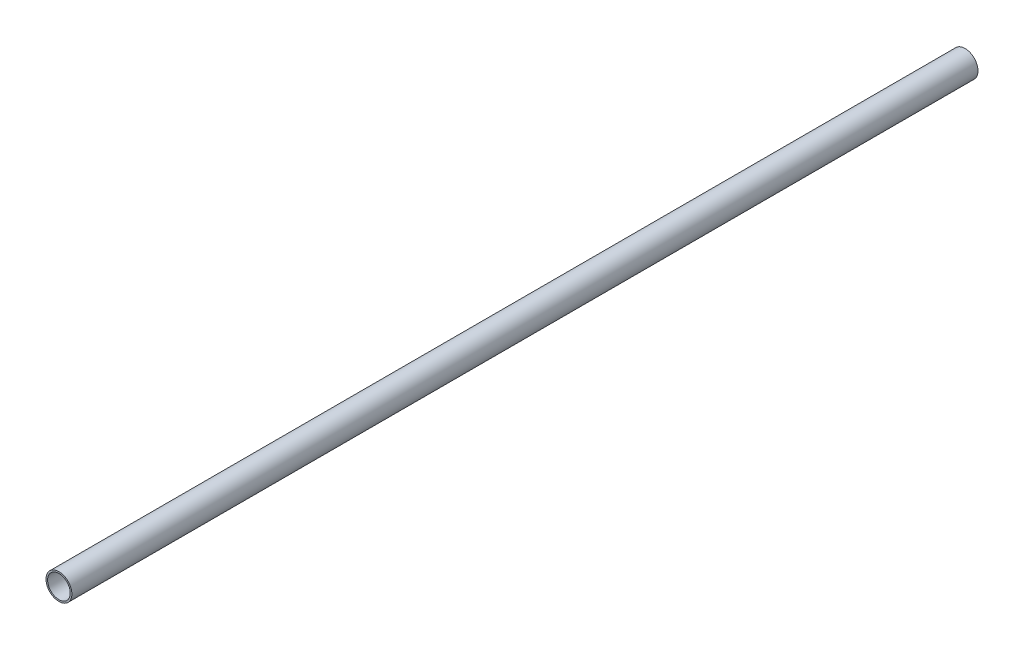
from build123d import *

# Parameters (mm, degrees)
SKETCH_1_R      = 4
SKETCH_1_R_2    = 3.5
EXTRUDE_1_DEPTH = 140


with BuildPart() as part:
    # Эскиз1 → Бобышка-Вытянуть1 (new, symmetric)
    with BuildSketch(Plane.XY):
        Circle(SKETCH_1_R)
        Circle(SKETCH_1_R_2, mode=Mode.SUBTRACT)
    extrude(amount=EXTRUDE_1_DEPTH, both=True)


solid = part.part
